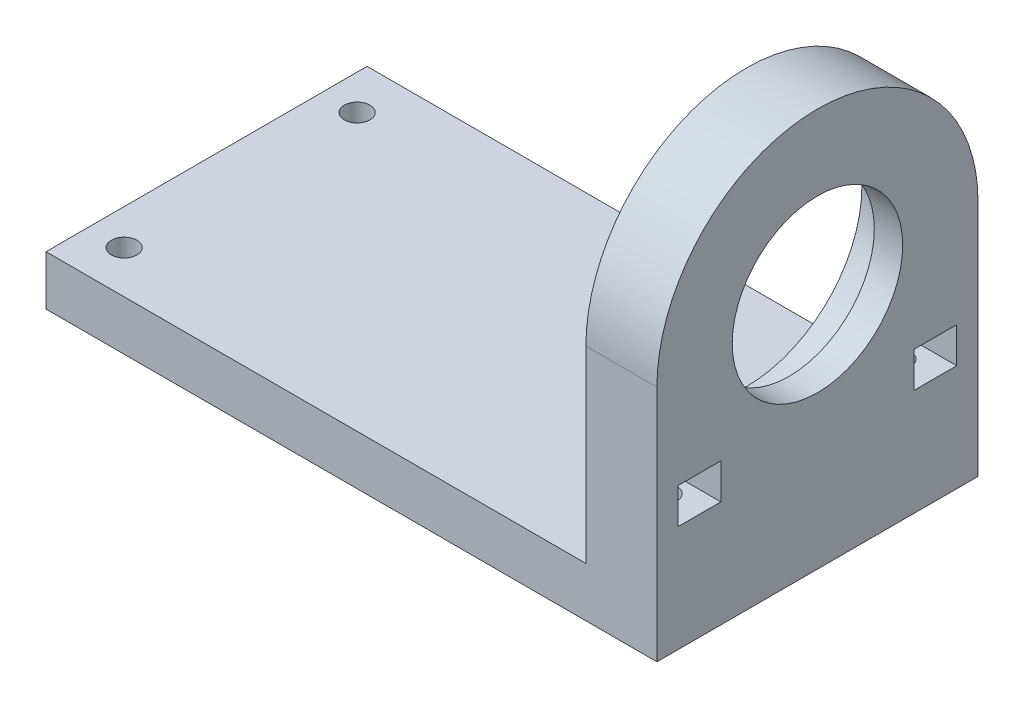
from build123d import *

# Parameters (mm, degrees)
SKETCH_1_W          = 86
SKETCH_1_H          = 45.2
EXTRUDE_1_DEPTH     = 7
SKETCH_4_R          = 12
SKETCH_4_W          = 6
SKETCH_4_H          = 5
EXTRUDE_2_DEPTH     = 10
SKETCH_5_R          = 16.25
CUT_EXTRUDE_1_DEPTH = 6
SKETCH_6_R          = 1.8
CUT_EXTRUDE_2_DEPTH = 20
SKETCH_7_R          = 3.5
CUT_EXTRUDE_3_DEPTH = 3.5


with BuildPart() as part:
    # 草图1 → 凸台-拉伸1 (new body)
    with BuildSketch(Plane(origin=(0, 0, 0), x_dir=(1, 0, 0), z_dir=(0, 1, 0))):
        with Locations((0, -3.4)):
            Rectangle(SKETCH_1_W, SKETCH_1_H)
    extrude(amount=EXTRUDE_1_DEPTH)

    # 草图4 → 凸台-拉伸2 (add)
    with BuildSketch(Plane(origin=(43, 0, 0), x_dir=(0, 0, -1), z_dir=(1, 0, 0))):
        with BuildLine():
            Line((19.2, 0), (-26, 0))
            Line((-26, 0), (-26, 33.5))
            ThreePointArc((-26, 33.5), (-3.4, 56.1), (19.2, 33.5))
            Line((19.2, 33.5), (19.2, 0))
        make_face()
        with Locations((-3.4, 33.5)):
            Circle(SKETCH_4_R, mode=Mode.SUBTRACT)
        with Locations((-20, 17.5)):
            Rectangle(SKETCH_4_W, SKETCH_4_H, mode=Mode.SUBTRACT)
        with Locations((13.2, 17.5)):
            Rectangle(SKETCH_4_W, SKETCH_4_H, mode=Mode.SUBTRACT)
    extrude(amount=-EXTRUDE_2_DEPTH)

    # 草图5 → 切除-拉伸1 (cut)
    with BuildSketch(Plane.ZY.offset(-33)):
        with Locations((3.4, 33.5)):
            Circle(SKETCH_5_R)
    extrude(amount=-CUT_EXTRUDE_1_DEPTH, mode=Mode.SUBTRACT)

    # 草图6 → 切除-拉伸2 (cut)
    with BuildSketch(Plane(origin=(0, 0, 0), x_dir=(1, 0, 0), z_dir=(0, 1, 0))):
        with Locations(Location((38, -20, 0), (0, 0, 90))):
            Circle(SKETCH_6_R)
        with Locations(Location((38.066919359, 12.870051801, 0), (0, 0, 90))):
            Circle(SKETCH_6_R)
    cut_extrude_2 = extrude(amount=CUT_EXTRUDE_2_DEPTH, mode=Mode.SUBTRACT)

    # 草图7 → 切除-拉伸3 (cut)
    with BuildSketch(Plane(origin=(0, 0, 0), x_dir=(1, 0, 0), z_dir=(0, 1, 0))):
        with Locations(Location((38, -20, 0), (0, 0, 270))):
            Circle(SKETCH_7_R)
        with Locations(Location((38, 13.2, 0), (0, 0, 90))):
            Circle(SKETCH_7_R)
    cut_extrude_3 = extrude(amount=CUT_EXTRUDE_3_DEPTH, mode=Mode.SUBTRACT)

    # 镜向1: 切除-拉伸2, 切除-拉伸3 across plane
    add(cut_extrude_2.mirror(Plane.ZY), mode=Mode.SUBTRACT)
    add(cut_extrude_3.mirror(Plane.ZY), mode=Mode.SUBTRACT)


solid = part.part
